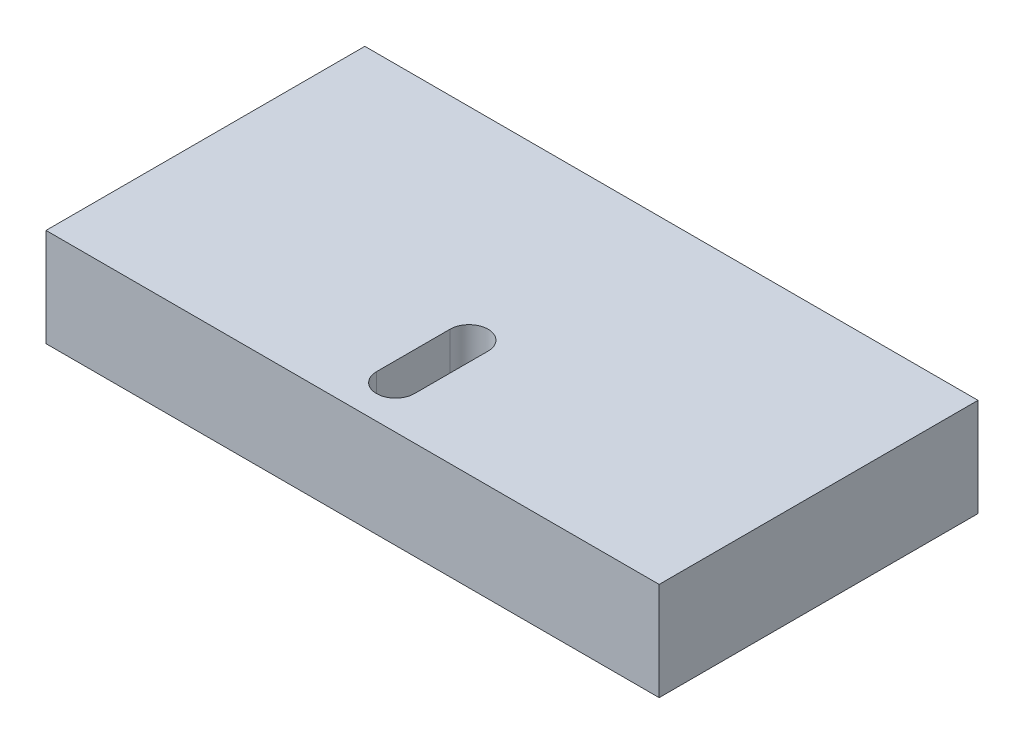
from build123d import *

# Parameters (mm, degrees)
CROQUIS1_W              = 50
CROQUIS1_H              = 26
SALIENTE_EXTRUIR1_DEPTH = 8


with BuildPart() as part:
    # Croquis1 → Saliente-Extruir1 (new body)
    with BuildSketch(Plane(origin=(0, 0, 0), x_dir=(1, 0, 0), z_dir=(0, 1, 0))):
        Rectangle(CROQUIS1_W, CROQUIS1_H)
        with BuildLine():
            Line((-1.55, -9.5), (-1.55, -3.5))
            ThreePointArc((-1.55, -3.5), (0, -1.95), (1.55, -3.5))
            Line((1.55, -3.5), (1.55, -9.5))
            ThreePointArc((1.55, -9.5), (0, -11.05), (-1.55, -9.5))
        make_face(mode=Mode.SUBTRACT)
    extrude(amount=SALIENTE_EXTRUIR1_DEPTH)


solid = part.part
